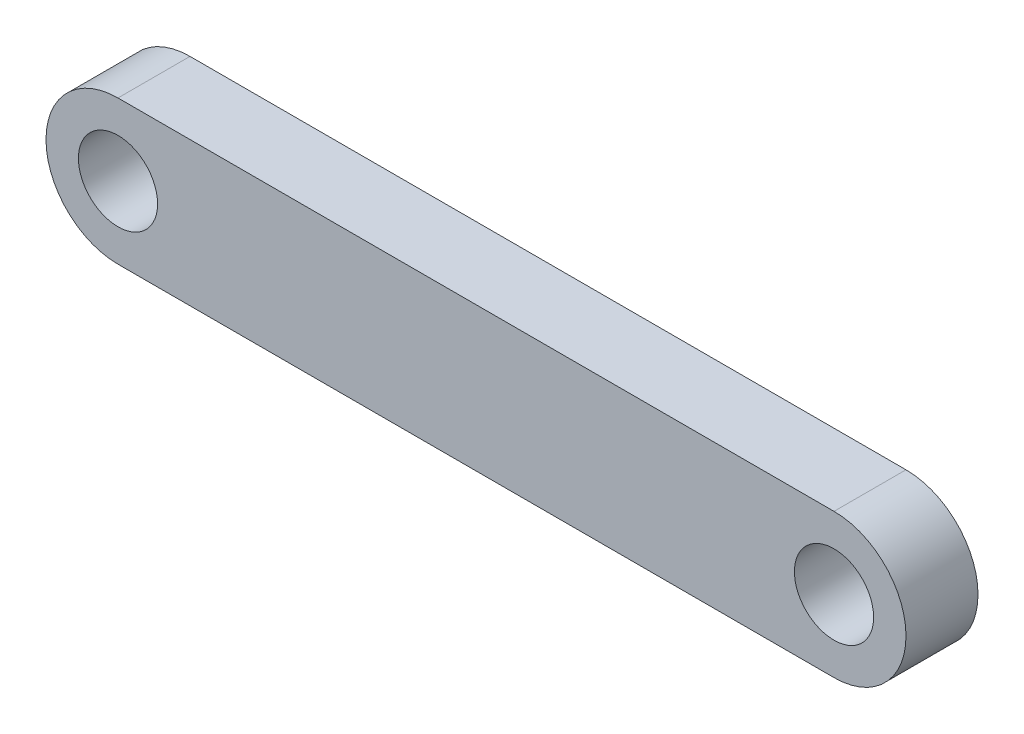
from build123d import *

# Parameters (mm, degrees)
SKETCH1_R           = 1.65
BOSS_EXTRUDE1_DEPTH = 3


with BuildPart() as part:
    # Sketch1 → Boss-Extrude1 (new body)
    with BuildSketch(Plane.XY):
        with BuildLine():
            Line((-14.917068363, 3.049371738), (14.917068363, 3.049371738))
            ThreePointArc((14.917068363, 3.049371738), (17.917068363, 0.049371738), (14.917068363, -2.950628262))
            Line((14.917068363, -2.950628262), (-14.917068363, -2.950628262))
            ThreePointArc((-14.917068363, -2.950628262), (-17.917068363, 0.049371738), (-14.917068363, 3.049371738))
        make_face()
        with Locations((-14.917068363, 0.049371738)):
            Circle(SKETCH1_R, mode=Mode.SUBTRACT)
        with Locations((14.917068363, 0.049371738)):
            Circle(SKETCH1_R, mode=Mode.SUBTRACT)
    extrude(amount=BOSS_EXTRUDE1_DEPTH)


solid = part.part
